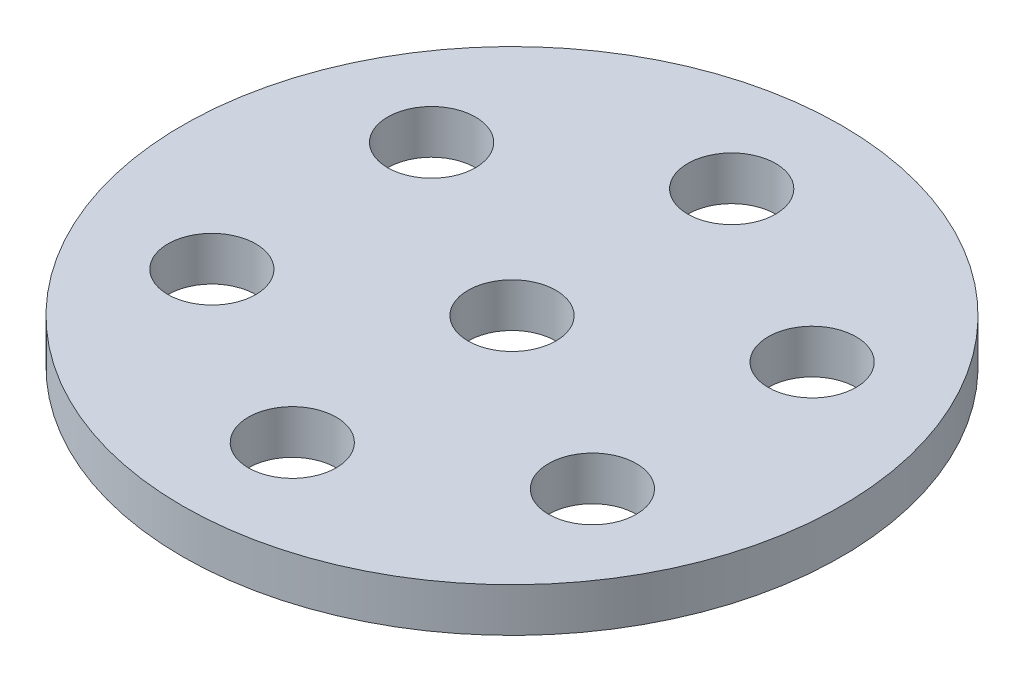
from build123d import *

# Parameters (mm, degrees)
SKETCH1_R           = 75
SKETCH1_R_2         = 10
BOSS_EXTRUDE2_DEPTH = 10


with BuildPart() as part:
    # Sketch1 → Boss-Extrude2 (new body)
    with BuildSketch(Plane(origin=(0, 0, 0), x_dir=(1, 0, 0), z_dir=(0, 1, 0))):
        with Locations(Location((0, 0, 0), (0, 0, 270))):
            Circle(SKETCH1_R)
        with Locations(Location((0, 0, 0), (0, 0, 270))):
            Circle(SKETCH1_R_2, mode=Mode.SUBTRACT)
        with Locations(Location((-43.301270189, 25, 0), (0, 0, 270))):
            Circle(SKETCH1_R_2, mode=Mode.SUBTRACT)
        with Locations(Location((-43.301270189, -25, 0), (0, 0, 270))):
            Circle(SKETCH1_R_2, mode=Mode.SUBTRACT)
        with Locations(Location((0, -50, 0), (0, 0, 270))):
            Circle(SKETCH1_R_2, mode=Mode.SUBTRACT)
        with Locations(Location((43.301270189, -25, 0), (0, 0, 270))):
            Circle(SKETCH1_R_2, mode=Mode.SUBTRACT)
        with Locations(Location((43.301270189, 25, 0), (0, 0, 270))):
            Circle(SKETCH1_R_2, mode=Mode.SUBTRACT)
        with Locations(Location((0, 50, 0), (0, 0, 270))):
            Circle(SKETCH1_R_2, mode=Mode.SUBTRACT)
    extrude(amount=BOSS_EXTRUDE2_DEPTH)


solid = part.part
